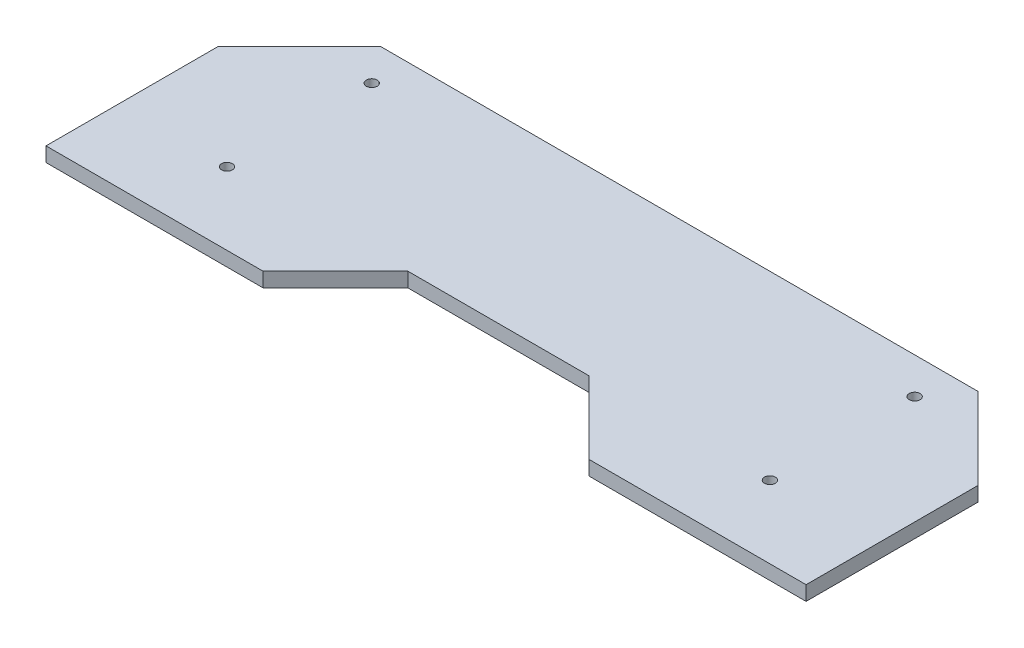
from build123d import *

# Parameters (mm, degrees)
EXTRUDE_1_DEPTH     = 4
SKETCH_2_R          = 1.5
CUT_EXTRUDE_1_DEPTH = 4
SKETCH_3_W          = 10
SKETCH_3_H          = 69.678883607
SKETCH_3_H_2        = 93.047687854
CUT_EXTRUDE_2_DEPTH = 4
CUT_EXTRUDE_3_DEPTH = 4


with BuildPart() as part:
    # 草图1 → 凸台-拉伸1 (new body)
    with BuildSketch(Plane(origin=(0, 0, 0), x_dir=(1, 0, 0), z_dir=(0, 1, 0))):
        Polygon((-67.5, -35), (-47.5, -15), (2.5, -15), (22.5, -35), (92.5, -35), (92.5, 15), (72.5, 35), (-117.5, 35), (-137.5, 15), (-137.5, -35), align=None)
    extrude(amount=EXTRUDE_1_DEPTH)

    # 草图2 → 切除-拉伸1 (cut)
    with BuildSketch(Plane(origin=(0, 4, 0), x_dir=(1, 0, 0), z_dir=(0, 1, 0))):
        with Locations(Location((-97.5, -15, 0), (0, 0, 270))):
            Circle(SKETCH_2_R)
        with Locations(Location((-97.5, 25, 0), (0, 0, 270))):
            Circle(SKETCH_2_R)
        with Locations(Location((52.5, 25, 0), (0, 0, 90))):
            Circle(SKETCH_2_R)
        with Locations(Location((52.5, -15, 0), (0, 0, 90))):
            Circle(SKETCH_2_R)
    extrude(amount=-CUT_EXTRUDE_1_DEPTH, mode=Mode.SUBTRACT)

    # 草图3 → 切除-拉伸2 (cut)
    with BuildSketch(Plane(origin=(0, 4, 0), x_dir=(1, 0, 0), z_dir=(0, 1, 0))):
        with Locations((-132.5, -0.160558196)):
            Rectangle(SKETCH_3_W, SKETCH_3_H)
        with Locations((87.5, 11.523843927)):
            Rectangle(SKETCH_3_W, SKETCH_3_H_2)
    extrude(amount=-CUT_EXTRUDE_2_DEPTH, mode=Mode.SUBTRACT)

    # 草图4 → 切除-拉伸3 (cut)
    with BuildSketch(Plane(origin=(0, 4, 0), x_dir=(1, 0, 0), z_dir=(0, 1, 0))):
        Polygon((-127.5, 12.5), (-92.197077218, 47.802922782), (-150.178982695, 47.802922782), align=None)
        Polygon((82.5, 12.5), (37.005283765, 57.994716235), (96.544114713, 56.205234398), align=None)
    extrude(amount=-CUT_EXTRUDE_3_DEPTH, mode=Mode.SUBTRACT)


solid = part.part
